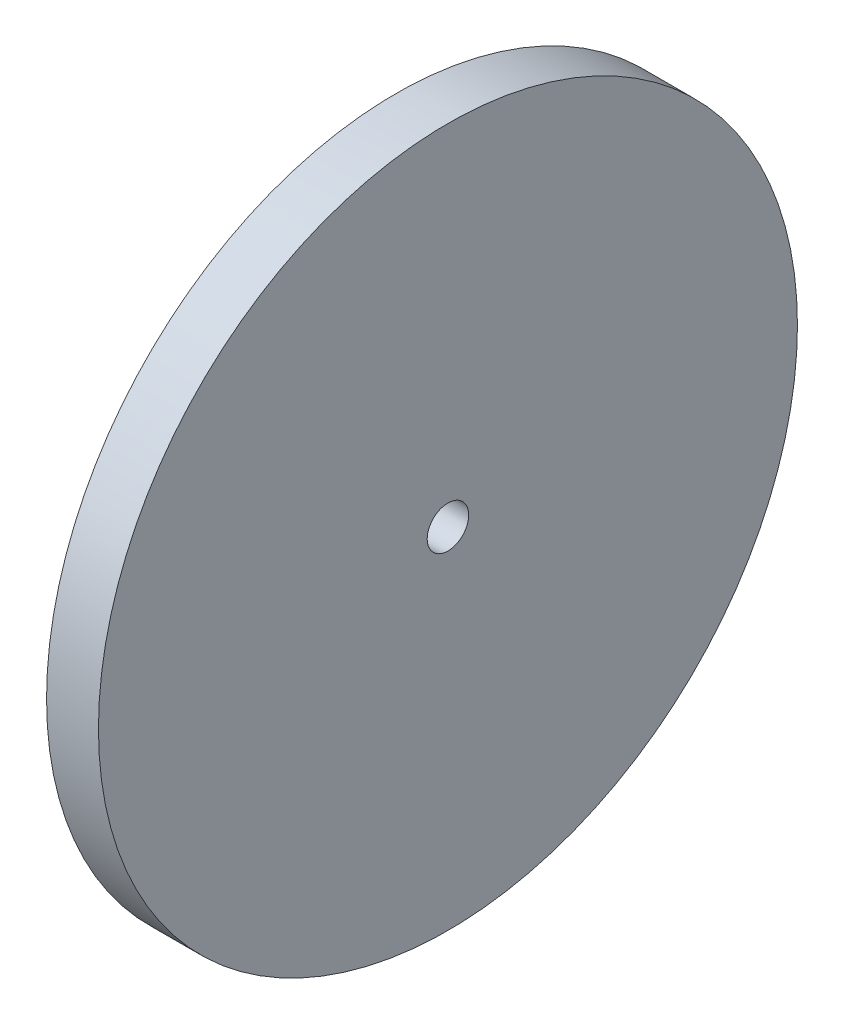
from build123d import *

# Parameters (mm, degrees)
BOSS_EXTRUDE1_DEPTH      = 2
BOSS_EXTRUDE1_DEPTH_BACK = 10
SKETCH1_R                = 80.821
SKETCH1_R_2              = 4.8


with BuildPart() as part:
    # Sketch1 → Boss-Extrude1 (new, two sides: drawn at the far end of the back side and taken through both)
    with BuildSketch(Plane.ZY.offset(497.172).offset(-BOSS_EXTRUDE1_DEPTH_BACK)):
        with Locations((43.229, 80.821)):
            Circle(SKETCH1_R)
        with Locations((43.229, 80.821)):
            Circle(SKETCH1_R_2, mode=Mode.SUBTRACT)
    extrude(amount=BOSS_EXTRUDE1_DEPTH + BOSS_EXTRUDE1_DEPTH_BACK)


solid = part.part
